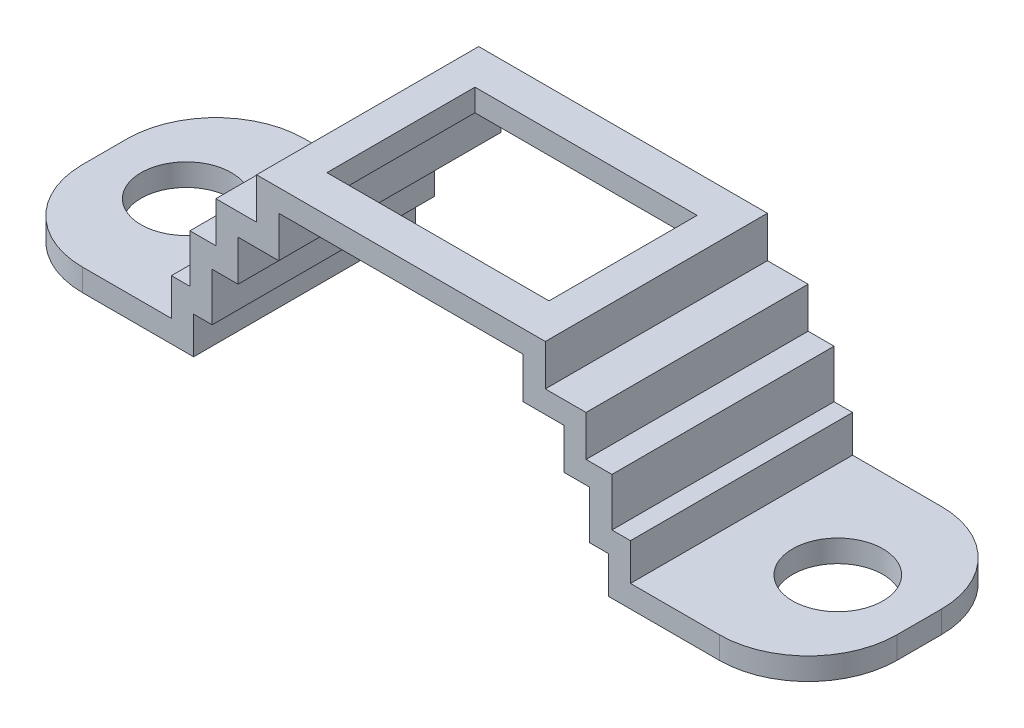
from build123d import *

# Parameters (mm, degrees)
EXTRUDE_THIN1_DEPTH  = 15
SKETCH2_R            = 6.1
CUT_EXTRUDE1_DEPTH   = 62.306626885
FILLET1_R            = 12
FILLET1_OF_MIRROR1_R = 12
SKETCH3_W            = 30
SKETCH3_H            = 20
CUT_EXTRUDE2_DEPTH   = 63.472413912


with BuildPart() as part:
    # Sketch1 → Extrude-Thin1 (new, symmetric)
    with BuildSketch(Plane.XY):
        Polygon((-55, 4.5), (-28, 4.5), (-28, 9.5), (-25.5, 9.5), (-25.5, 16), (-22, 16), (-22, 21.5), (-16.5, 21.5), (-16.5, 27.05), (0, 27.05), (0, 30.05), (-19.5, 30.05), (-19.5, 24.5), (-25, 24.5), (-25, 19), (-28.5, 19), (-28.5, 12.5), (-31, 12.5), (-31, 7.5), (-55, 7.5), align=None)
    extrude_thin1 = extrude(amount=EXTRUDE_THIN1_DEPTH, both=True)

    # Sketch2 → Cut-Extrude1 (cut, through all)
    with BuildSketch(Plane(origin=(0, 7.5, 0), x_dir=(1, 0, 0), z_dir=(0, 1, 0))):
        with Locations(Location((-44, 0, 0), (0, 0, 270))):
            Circle(SKETCH2_R)
    cut_extrude1 = extrude(amount=-CUT_EXTRUDE1_DEPTH, mode=Mode.SUBTRACT)

    # Fillet1
    fillet1_edges = [part.edges().sort_by_distance(p)[0] for p in [
        (-55, 6, -15),
        (-55, 6, 15),
    ]]
    fillet(fillet1_edges, radius=FILLET1_R)

    # Mirror1: Extrude-Thin1, Cut-Extrude1 across plane
    add(extrude_thin1.mirror(Plane(origin=(0, 30.05, 15), x_dir=(0, 0, 1), z_dir=(1, 0, 0))))
    add(cut_extrude1.mirror(Plane(origin=(0, 30.05, 15), x_dir=(0, 0, 1), z_dir=(1, 0, 0))), mode=Mode.SUBTRACT)

    # Fillet1 of Mirror1
    fillet1_of_mirror1_edges = [part.edges().sort_by_distance(p)[0] for p in [
        (55, 6, -15),
        (55, 6, 15),
    ]]
    fillet(fillet1_of_mirror1_edges, radius=FILLET1_OF_MIRROR1_R)

    # Sketch3 → Cut-Extrude2 (cut, through all)
    with BuildSketch(Plane(origin=(0, 30.05, 0), x_dir=(1, 0, 0), z_dir=(0, 1, 0))):
        Rectangle(SKETCH3_W, SKETCH3_H)
    extrude(amount=-CUT_EXTRUDE2_DEPTH, mode=Mode.SUBTRACT)


solid = part.part
